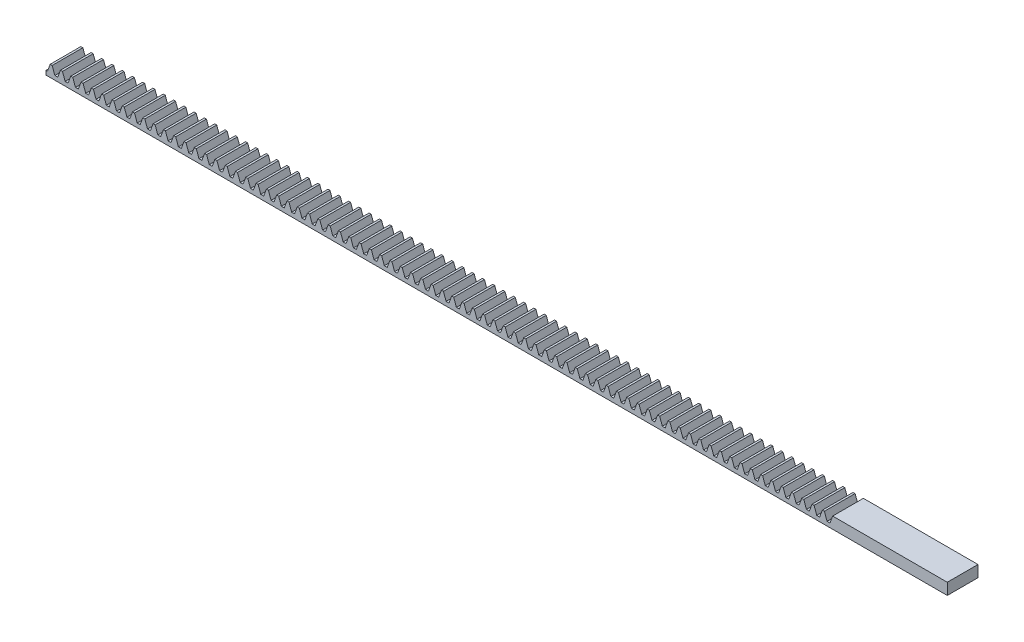
from build123d import *

# Parameters (mm, degrees)
BLANKSKE_W        = 220
BLANKSKE_H        = 2.8
BLANK_DEPTH       = 7.5
TOOTHCUTSIM_DEPTH = 221.145610903
TEETHCUTS_COUNT   = 77
TEETHCUTS_PITCH   = 2.51327412


with BuildPart() as part:
    # BlankSke → Blank (new body)
    with BuildSketch(Plane.XY):
        with Locations((110, 1.4)):
            Rectangle(BLANKSKE_W, BLANKSKE_H)
    extrude(amount=-BLANK_DEPTH)

    # TooCutSkeSim → ToothCutSim (cut, through all)
    with BuildSketch(Plane.XY):
        Polygon((0.354348296, 1), (-0.354348296, 1), (-1.018739561, 2.8254), (1.018739561, 2.8254), align=None)
    toothcutsim = extrude(amount=-TOOTHCUTSIM_DEPTH, mode=Mode.SUBTRACT)

    # TeethCuts: ToothCutSim ×77
    with Locations(*[(i * TEETHCUTS_PITCH, 0, 0) for i in range(1, TEETHCUTS_COUNT)]):
        add(toothcutsim, mode=Mode.SUBTRACT)


solid = part.part
